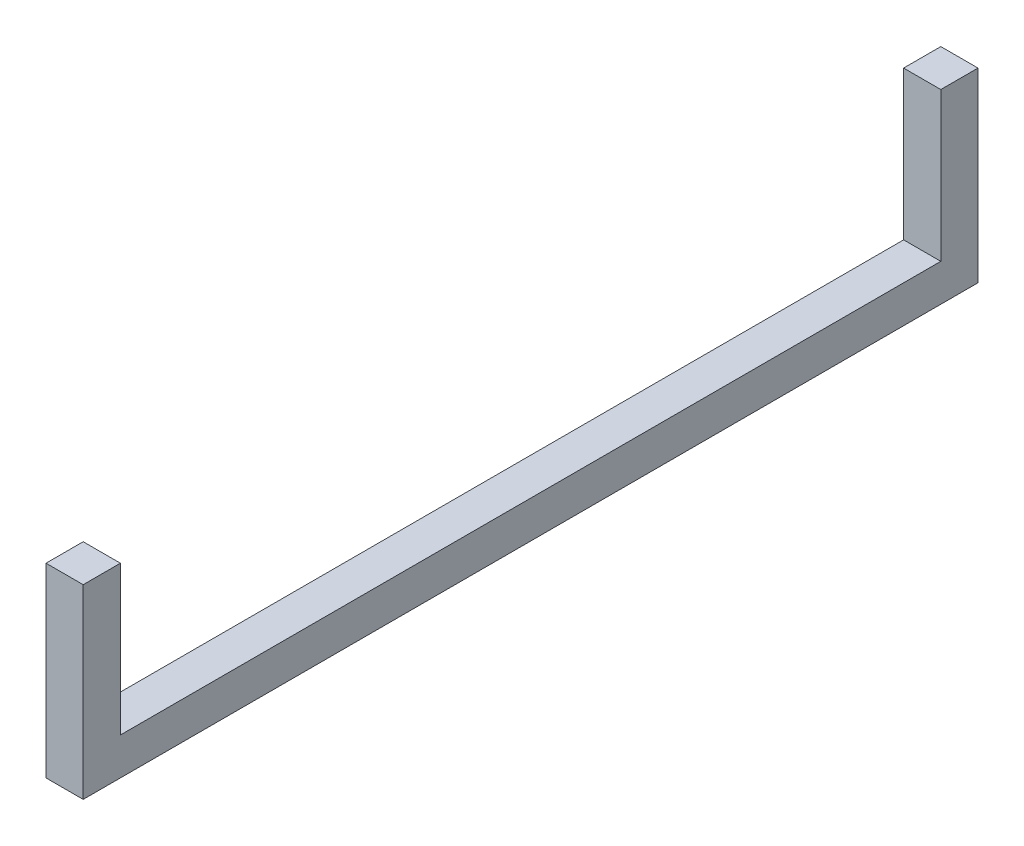
from build123d import *

# Parameters (mm, degrees)
ESQUISSE1_W        = 5
ESQUISSE1_H        = 5
BOSS_EXTRU_1_DEPTH = 120.28
ESQUISSE3_W        = 5
ESQUISSE3_H        = 5
BOSS_EXTRU_2_DEPTH = 20


with BuildPart() as part:
    # Esquisse1 → Boss.-Extru.1 (new body)
    with BuildSketch(Plane.XY):
        Rectangle(ESQUISSE1_W, ESQUISSE1_H)
    extrude(amount=BOSS_EXTRU_1_DEPTH)

    # Esquisse3 → Boss.-Extru.2 (add)
    with BuildSketch(Plane(origin=(0, 2.5, 0), x_dir=(1, 0, 0), z_dir=(0, 1, 0))):
        with Locations((0, -2.5)):
            Rectangle(ESQUISSE3_W, ESQUISSE3_H)
        with Locations((0, -117.78)):
            Rectangle(ESQUISSE3_W, ESQUISSE3_H)
    extrude(amount=BOSS_EXTRU_2_DEPTH)


solid = part.part
